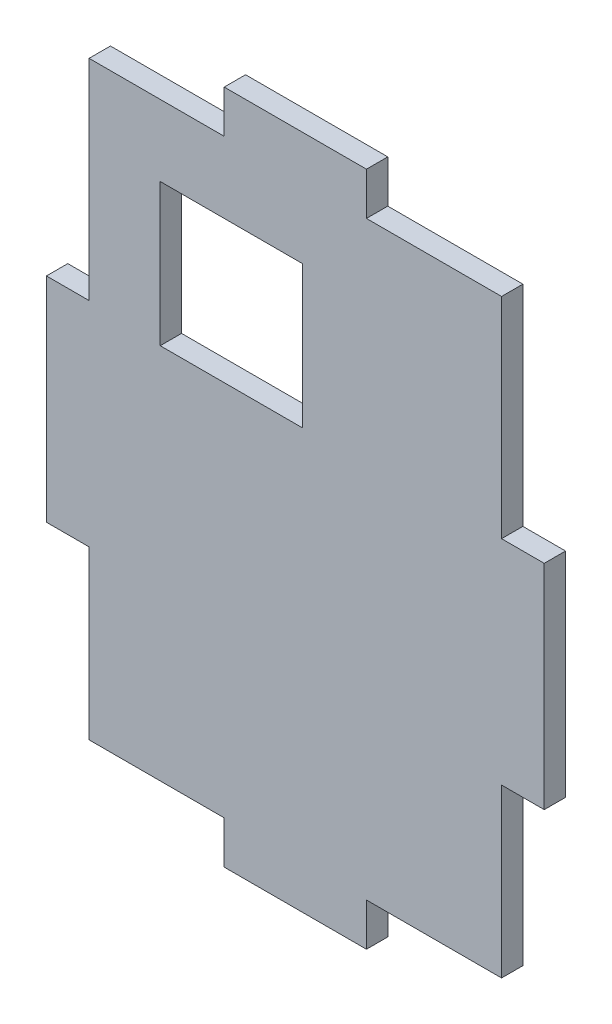
from build123d import *

# Parameters (mm, degrees)
ESQUISSE1_W             = 70
ESQUISSE1_H             = 95
BOSS_EXTRU_1_DEPTH      = 3
ESQUISSE2_W             = 20
ESQUISSE2_H             = 20
ENL_V_MAT_EXTRU_1_DEPTH = 119.042365276


with BuildPart() as part:
    # Esquisse1 → Boss.-Extru.1 (new body)
    with BuildSketch(Plane.XY):
        with Locations((-35, 47.5)):
            Rectangle(ESQUISSE1_W, ESQUISSE1_H)
    extrude(amount=BOSS_EXTRU_1_DEPTH)

    # Esquisse2 → Enlèv. mat.-Extru.1 (cut, through all)
    with BuildSketch(Plane(origin=(0, 0, 0), x_dir=(-1, 0, 0), z_dir=(0, 0, -1))):
        Polygon((0, 95), (25, 95), (25, 89), (6, 89), (6, 59.5), (0, 59.5), align=None)
        Polygon((70, 95), (45, 95), (45, 89), (64, 89), (64, 59.5), (70, 59.5), align=None)
        Polygon((0, 0), (25, 0), (25, 6), (6, 6), (6, 29.5), (0, 29.5), align=None)
        Polygon((45, 0), (70, 0), (70, 29.5), (64, 29.5), (64, 6), (45, 6), align=None)
        with Locations((44, 69)):
            Rectangle(ESQUISSE2_W, ESQUISSE2_H)
    extrude(amount=-ENL_V_MAT_EXTRU_1_DEPTH, mode=Mode.SUBTRACT)


solid = part.part
